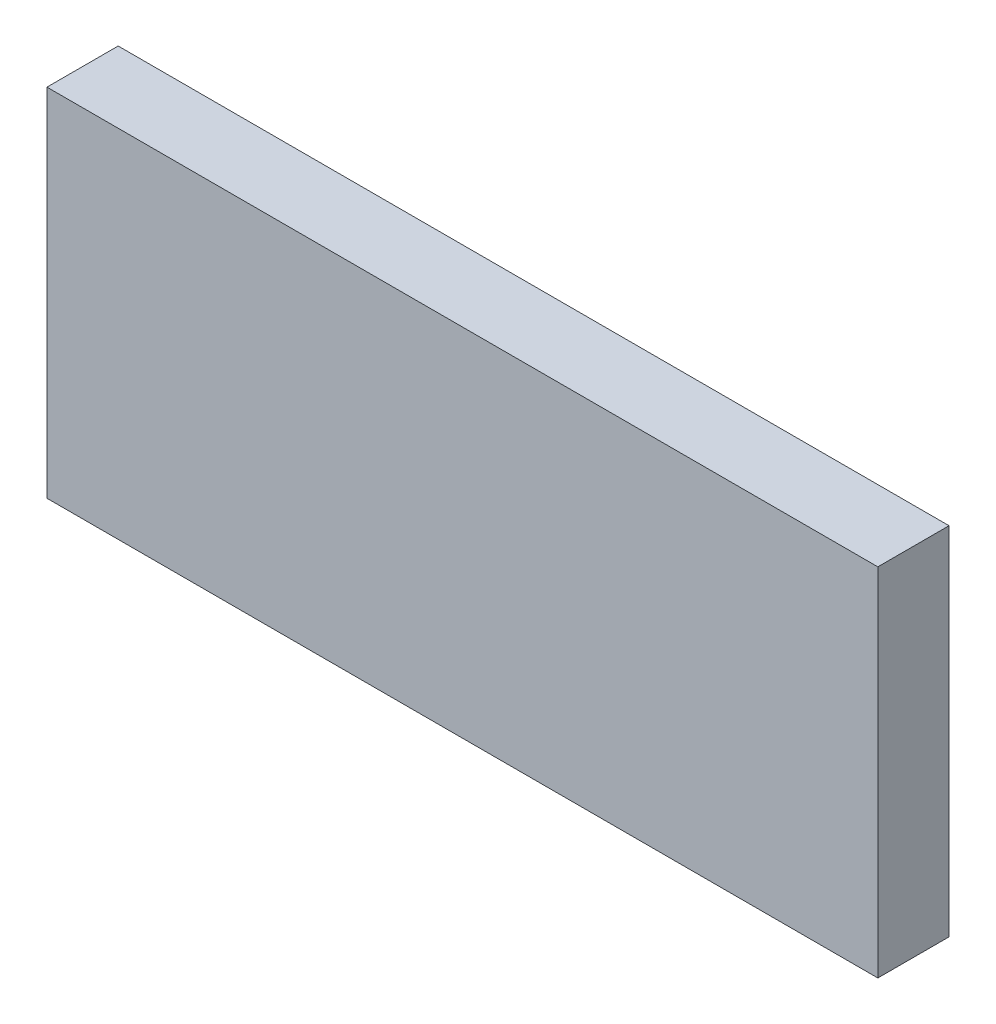
from build123d import *

# Parameters (mm, degrees)
SKETCH1_W           = 17.5
SKETCH1_H           = 7.5
BOSS_EXTRUDE1_DEPTH = 1.5
SCALE1_SCALE        = 10


with BuildPart() as part:
    # Sketch1 → Boss-Extrude1 (new body)
    with BuildSketch(Plane.XY):
        with Locations((8.75, 3.75)):
            Rectangle(SKETCH1_W, SKETCH1_H)
    extrude(amount=BOSS_EXTRUDE1_DEPTH)


with BuildPart() as part_1:
    # Scale1: scaled about (0, 0, 0)
    add(part.part.scale(SCALE1_SCALE))


solid = part_1.part
